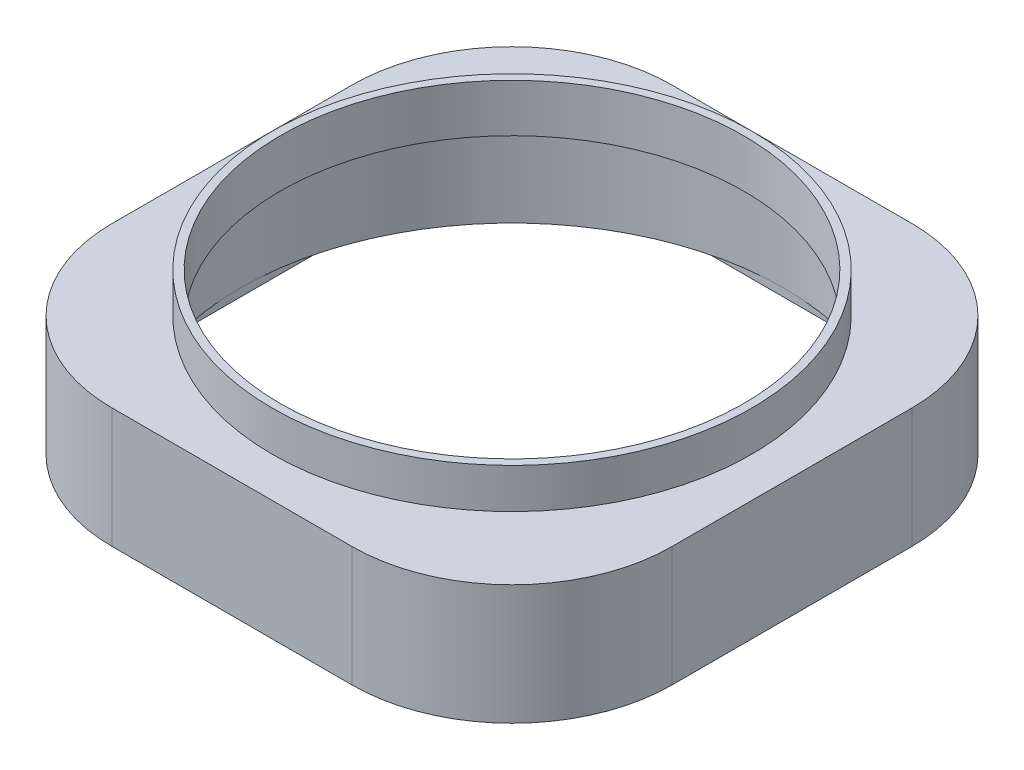
from build123d import *

# Parameters (mm, degrees)
BOSS_EXTRUDE1_DEPTH = 40
SKETCH2_R           = 60
BOSS_EXTRUDE2_DEPTH = 10
SKETCH3_R           = 58
CUT_EXTRUDE1_DEPTH  = 12
SKETCH5_R           = 68
CUT_EXTRUDE3_DEPTH  = 38
SKETCH7_W           = 152.426139127
SKETCH7_H           = 144.716969628
CUT_EXTRUDE4_DEPTH  = 10
CUT_EXTRUDE6_DEPTH  = 2


with BuildPart() as part:
    # Sketch1 → Boss-Extrude1 (new body)
    with BuildSketch(Plane(origin=(0, 0, 0), x_dir=(1, 0, 0), z_dir=(0, 1, 0))):
        with BuildLine():
            Line((-30, 70), (30, 70))
            ThreePointArc((30, 70), (58.284271247, 58.284271247), (70, 30))
            Line((70, 30), (70, -30))
            ThreePointArc((70, -30), (58.284271247, -58.284271247), (30, -70))
            Line((30, -70), (-30, -70))
            ThreePointArc((-30, -70), (-58.284271247, -58.284271247), (-70, -30))
            Line((-70, -30), (-70, 30))
            ThreePointArc((-70, 30), (-58.284271247, 58.284271247), (-30, 70))
        make_face()
    extrude(amount=-BOSS_EXTRUDE1_DEPTH)

    # Sketch2 → Boss-Extrude2 (add)
    with BuildSketch(Plane(origin=(0, 0, 0), x_dir=(1, 0, 0), z_dir=(0, 1, 0))):
        with Locations(Location((0, 0, 0), (0, 0, 270))):
            Circle(SKETCH2_R)
    extrude(amount=BOSS_EXTRUDE2_DEPTH)

    # Sketch3 → Cut-Extrude1 (cut)
    with BuildSketch(Plane(origin=(0, 10, 0), x_dir=(1, 0, 0), z_dir=(0, 1, 0))):
        with Locations(Location((0, 0, 0), (0, 0, 270))):
            Circle(SKETCH3_R)
    extrude(amount=-CUT_EXTRUDE1_DEPTH, mode=Mode.SUBTRACT)

    # Sketch5 → Cut-Extrude3 (cut)
    with BuildSketch(Plane.XZ.offset(40)):
        with Locations(Location((0, 0, 0), (0, 0, 270))):
            Circle(SKETCH5_R)
    extrude(amount=-CUT_EXTRUDE3_DEPTH, mode=Mode.SUBTRACT)

    # Sketch7 → Cut-Extrude4 (cut)
    with BuildSketch(Plane.XZ.offset(40)):
        with Locations((-0.48756258, -1.365678106)):
            Rectangle(SKETCH7_W, SKETCH7_H)
    extrude(amount=-CUT_EXTRUDE4_DEPTH, mode=Mode.SUBTRACT)

    # Sketch8 → Cut-Extrude6 (cut)
    with BuildSketch(Plane.XZ.offset(30)):
        with BuildLine():
            Line((68, 30), (68, -30))
            ThreePointArc((68, -30), (56.870057685, -56.870057685), (30, -68))
            Line((30, -68), (-30, -68))
            ThreePointArc((-30, -68), (-56.870057685, -56.870057685), (-68, -30))
            Line((-68, -30), (-68, 30))
            ThreePointArc((-68, 30), (-56.870057685, 56.870057685), (-30, 68))
            Line((-30, 68), (30, 68))
            ThreePointArc((30, 68), (56.870057685, 56.870057685), (68, 30))
        make_face()
    extrude(amount=-CUT_EXTRUDE6_DEPTH, mode=Mode.SUBTRACT)


solid = part.part
